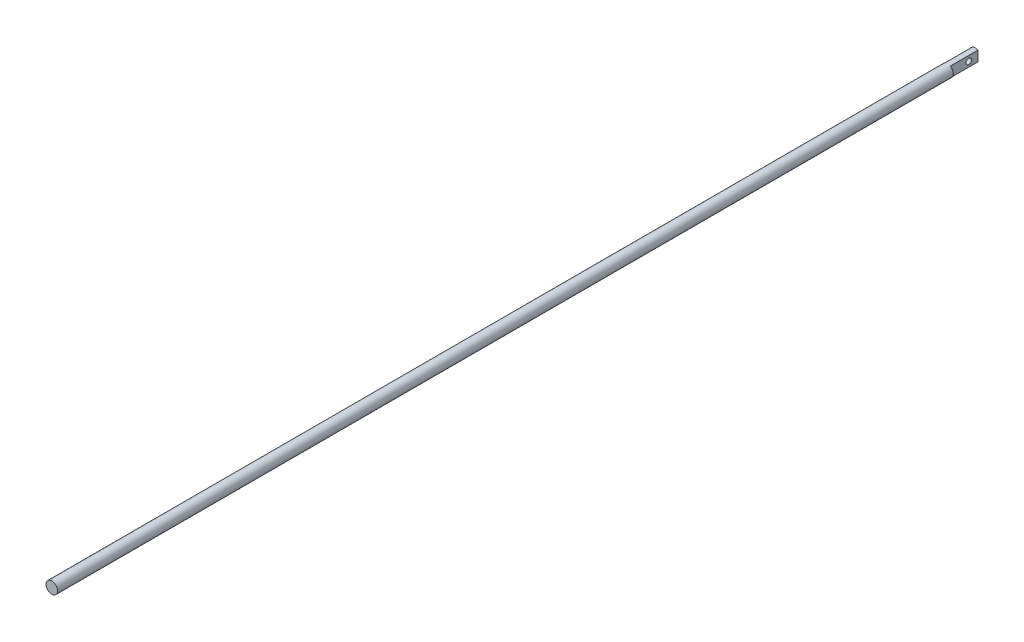
from build123d import *

# Parameters (mm, degrees)
SKETCH1_R                      = 1.5875
BOSS_EXTRUDE1_DEPTH            = 254
CUT_EXTRUDE1_DEPTH             = 255.009921681
CUT_EXTRUDE1_DEPTH_BACK        = 255.009921681
SKETCH2_W                      = 0.8255
SKETCH2_H                      = 7.62
CUT_EXTRUDE2_REACH             = 256.01
SKETCH3_R                      = 0.762
CUT_EXTRUDE2_DIRECTION_2_REACH = 256.01


with BuildPart() as part:
    # Sketch1 → Boss-Extrude1 (new body)
    with BuildSketch(Plane.XY):
        Circle(SKETCH1_R)
    extrude(amount=BOSS_EXTRUDE1_DEPTH)

    # Sketch2 → Cut-Extrude1 (cut, two sides: drawn at the far end of the back side and taken through both)
    with BuildSketch(Plane(origin=(0, 0, 0), x_dir=(1, 0, 0), z_dir=(0, 1, 0)).offset(-CUT_EXTRUDE1_DEPTH_BACK)):
        with Locations((1.17475, -3.81)):
            Rectangle(SKETCH2_W, SKETCH2_H)
        with Locations((-1.17475, -3.81)):
            Rectangle(SKETCH2_W, SKETCH2_H)
    extrude(amount=CUT_EXTRUDE1_DEPTH + CUT_EXTRUDE1_DEPTH_BACK, mode=Mode.SUBTRACT)

    # Sketch3 → Cut-Extrude2 (cut, up to next)
    with BuildSketch(Plane(origin=(0, 0, 0), x_dir=(0, 0, -1), z_dir=(1, 0, 0)), mode=Mode.PRIVATE) as cut_extrude2_sk1:
        with Locations(Location((-2.54, 0, 0), (0, 0, 180))):
            Circle(SKETCH3_R)
    cut_extrude2_tool1 = extrude(cut_extrude2_sk1.sketch, amount=-CUT_EXTRUDE2_REACH, mode=Mode.PRIVATE) & part.part
    add(cut_extrude2_tool1.solids().sort_by_distance((0, 0, 2.54))[0], mode=Mode.SUBTRACT)

    # Sketch3 → Cut-Extrude2 direction 2 (cut, up to next)
    with BuildSketch(Plane(origin=(0, 0, 0), x_dir=(0, 0, -1), z_dir=(1, 0, 0)), mode=Mode.PRIVATE) as cut_extrude2_direction_2_sk1:
        with Locations(Location((-2.54, 0, 0), (0, 0, 180))):
            Circle(SKETCH3_R)
    cut_extrude2_direction_2_tool1 = extrude(cut_extrude2_direction_2_sk1.sketch, amount=CUT_EXTRUDE2_DIRECTION_2_REACH, mode=Mode.PRIVATE) & part.part
    add(cut_extrude2_direction_2_tool1.solids().sort_by_distance((0, 0, 2.54))[0], mode=Mode.SUBTRACT)


solid = part.part
